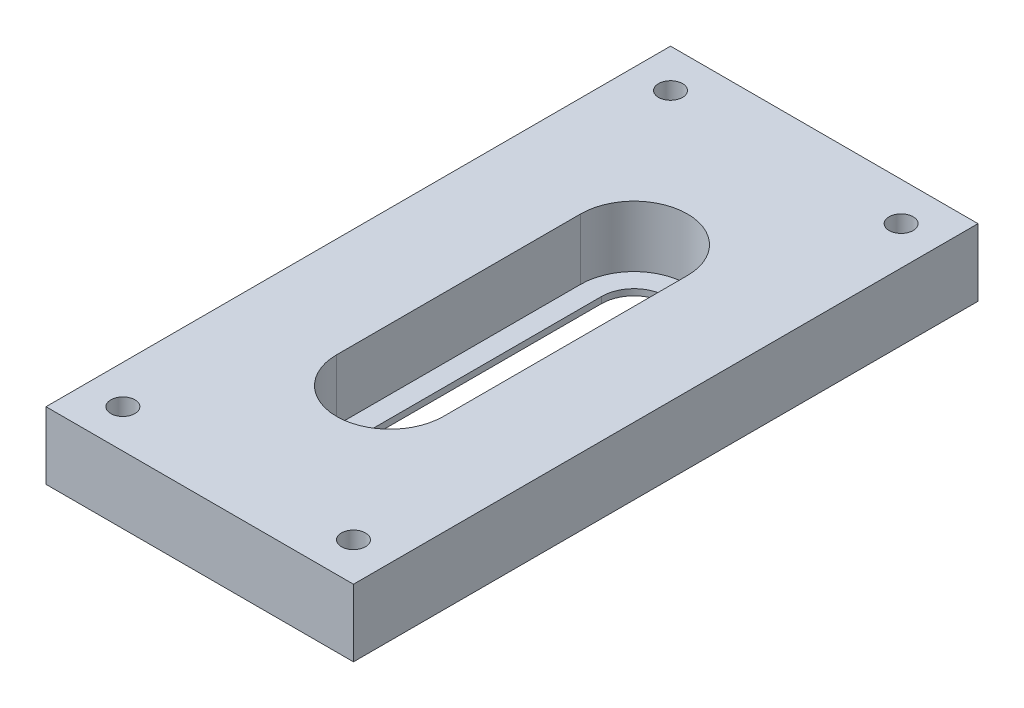
from build123d import *

# Parameters (mm, degrees)
SKETCH1_W                                        = 32
SKETCH1_H                                        = 65
BOSS_EXTRUDE1_DEPTH                              = 7
TAP_DRILL_FOR_M3X0_5_TAP1_D                      = 2.5
CBORE_FOR_1_4_SOCKET_HEAD_CAP_SCREW1_D           = 6.7564
CBORE_FOR_1_4_SOCKET_HEAD_CAP_SCREW1_CBORE_D     = 11.1125
CBORE_FOR_1_4_SOCKET_HEAD_CAP_SCREW1_CBORE_DEPTH = 6.35
SKETCH6_W                                        = 11.1125
SKETCH6_H                                        = 25.4
CUT_EXTRUDE1_DEPTH                               = 6.35
SKETCH7_W                                        = 6.7564
SKETCH7_H                                        = 25.4
CUT_EXTRUDE2_DEPTH                               = 87.167337251


with BuildPart() as part:
    # Sketch1 → Boss-Extrude1 (new body)
    with BuildSketch(Plane.XZ.offset(-27.928124556)):
        with Locations((22.96435644, 44.091555907)):
            Rectangle(SKETCH1_W, SKETCH1_H)
    extrude(amount=BOSS_EXTRUDE1_DEPTH)

    # Tap Drill for M3x0.5 Tap1 (through all)
    with Locations(Plane(origin=(0, 27.928124556, 0), x_dir=(1, 0, 0), z_dir=(0, 1, 0))):
        with Locations((10.96435606, -15.591555987), (34.96435632, -15.591555987), (34.96435632, -72.591556287), (10.96435606, -72.591556287)):
            Hole(TAP_DRILL_FOR_M3X0_5_TAP1_D / 2)

    # CBORE for 1/4 Socket Head Cap Screw1 (through all)
    with Locations(Plane(origin=(0, 27.928124556, 0), x_dir=(1, 0, 0), z_dir=(0, 1, 0))):
        with Locations((22.96435644, -31.391555907), (22.96435644, -56.791555907)):
            CounterBoreHole(CBORE_FOR_1_4_SOCKET_HEAD_CAP_SCREW1_D / 2, CBORE_FOR_1_4_SOCKET_HEAD_CAP_SCREW1_CBORE_D / 2, CBORE_FOR_1_4_SOCKET_HEAD_CAP_SCREW1_CBORE_DEPTH)

    # Sketch6 → Cut-Extrude1 (cut)
    with BuildSketch(Plane(origin=(0, 27.928124556, 0), x_dir=(1, 0, 0), z_dir=(0, 1, 0))):
        with Locations((22.96435644, -44.091555907)):
            Rectangle(SKETCH6_W, SKETCH6_H)
    extrude(amount=-CUT_EXTRUDE1_DEPTH, mode=Mode.SUBTRACT)

    # Sketch7 → Cut-Extrude2 (cut, through all)
    with BuildSketch(Plane(origin=(0, 21.578124556, 0), x_dir=(1, 0, 0), z_dir=(0, 1, 0))):
        with Locations((22.96435644, -44.091555907)):
            Rectangle(SKETCH7_W, SKETCH7_H)
    extrude(amount=-CUT_EXTRUDE2_DEPTH, mode=Mode.SUBTRACT)


solid = part.part
